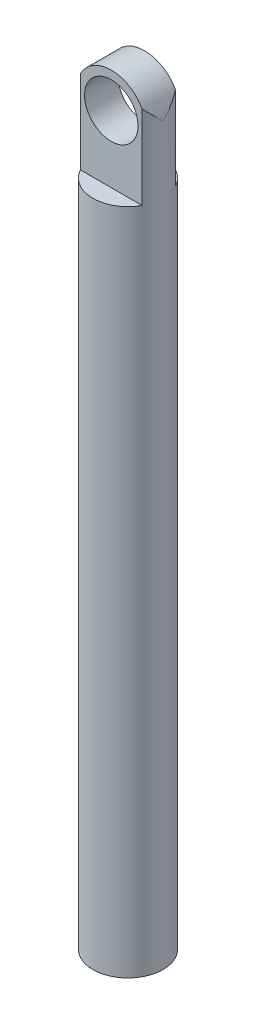
from build123d import *

# Parameters (mm, degrees)
SKETCH1_R           = 5.25
BOSS_EXTRUDE1_DEPTH = 100
BOSS_EXTRUDE2_DEPTH = 2.5
SKETCH3_OUTSIDE_W   = 35.74
SKETCH3_OUTSIDE_H   = 35.74
SKETCH3_OUTSIDE_R   = 5.25
CUT_EXTRUDE1_DEPTH  = 101.275246198
SKETCH4_R           = 4
CUT_EXTRUDE2_DEPTH  = 116.629526938
SKETCH5_R           = 2.65
CUT_EXTRUDE3_DEPTH  = 6


with BuildPart() as part:
    # Sketch1 → Boss-Extrude1 (new body)
    with BuildSketch(Plane(origin=(0, 0, 0), x_dir=(1, 0, 0), z_dir=(0, 1, 0))):
        with Locations(Location((0, 0, 0), (0, 0, 270))):
            Circle(SKETCH1_R)
    extrude(amount=BOSS_EXTRUDE1_DEPTH)

    # Sketch2 → Boss-Extrude2 (add, symmetric)
    with BuildSketch(Plane.XY):
        with BuildLine():
            Line((-5.25, 100), (-5.25, 110))
            ThreePointArc((-5.25, 110), (0, 115.25), (5.25, 110))
            Line((5.25, 110), (5.25, 100))
            Line((5.25, 100), (-5.25, 100))
        make_face()
    extrude(amount=BOSS_EXTRUDE2_DEPTH, both=True)

    # Sketch3 outside → Cut-Extrude1 (cut, through all)
    with BuildSketch(Plane(origin=(0, 100, 0), x_dir=(1, 0, 0), z_dir=(0, 1, 0))):
        Rectangle(SKETCH3_OUTSIDE_W, SKETCH3_OUTSIDE_H)
        with Locations(Location((0, 0, 0), (0, 0, 151.563109851))):
            Circle(SKETCH3_OUTSIDE_R, mode=Mode.SUBTRACT)
    extrude(amount=CUT_EXTRUDE1_DEPTH, mode=Mode.SUBTRACT)

    # Sketch4 → Cut-Extrude2 (cut, through all)
    with BuildSketch(Plane.XY.offset(2.5)):
        with Locations((0, 110)):
            Circle(SKETCH4_R)
    extrude(amount=-CUT_EXTRUDE2_DEPTH, mode=Mode.SUBTRACT)

    # Sketch5 → Cut-Extrude3 (cut)
    with BuildSketch(Plane.XZ):
        with Locations(Location((0, 0, 0), (0, 0, 270))):
            Circle(SKETCH5_R)
    extrude(amount=-CUT_EXTRUDE3_DEPTH, mode=Mode.SUBTRACT)


solid = part.part
